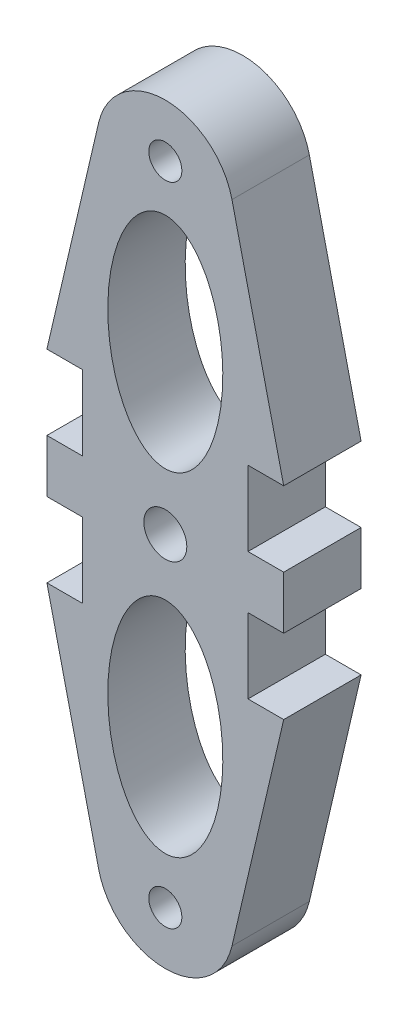
from build123d import *

# Parameters (mm, degrees)
SKETCH1_R           = 1.25
SKETCH1_R_2         = 1.625
SKETCH1_RX          = 8.302080555
SKETCH1_RY          = 4.346497416
BOSS_EXTRUDE1_DEPTH = 5.85


with BuildPart() as part:
    # Sketch1 → Boss-Extrude1 (new body)
    with BuildSketch(Plane.XY):
        with BuildLine():
            Line((781.409168709, 465.402542), (778.709168709, 465.402542))
            Line((778.709168709, 465.402542), (778.709168709, 461.402176393))
            Line((778.709168709, 461.402176393), (781.409168709, 461.402176393))
            Line((781.409168709, 461.402176393), (781.409168709, 455.752176393))
            Line((781.409168709, 455.752176393), (778.709168709, 455.752176393))
            Line((778.709168709, 455.752176393), (782.620179881, 438.967359197))
            ThreePointArc((782.620179881, 438.967359197), (787.659168709, 434.967516139), (792.698157537, 438.967359197))
            Line((792.698157537, 438.967359197), (796.609168709, 455.752176393))
            Line((796.609168709, 455.752176393), (793.909168709, 455.752176393))
            Line((793.909168709, 455.752176393), (793.909168709, 461.402176393))
            Line((793.909168709, 461.402176393), (796.609168709, 461.402176393))
            Line((796.609168709, 461.402176393), (796.609168709, 465.402542))
            Line((796.609168709, 465.402542), (793.909168709, 465.402542))
            Line((793.909168709, 465.402542), (793.909168709, 471.052542))
            Line((793.909168709, 471.052542), (796.609168709, 471.052542))
            Line((796.609168709, 471.052542), (792.698157537, 487.837359197))
            ThreePointArc((792.698157537, 487.837359197), (787.659168709, 491.837202254), (782.620179881, 487.837359197))
            Line((782.620179881, 487.837359197), (778.709168709, 471.052542))
            Line((778.709168709, 471.052542), (781.409168709, 471.052542))
            Line((781.409168709, 471.052542), (781.409168709, 465.402542))
        make_face()
        with Locations((787.659168709, 487.837359197)):
            Circle(SKETCH1_R, mode=Mode.SUBTRACT)
        with Locations((787.659168709, 438.967359197)):
            Circle(SKETCH1_R, mode=Mode.SUBTRACT)
        with Locations((787.659168709, 463.402359197)):
            Circle(SKETCH1_R_2, mode=Mode.SUBTRACT)
        with Locations(Location((787.659168709, 475.998301041), (0, 0, -90))):
            Ellipse(SKETCH1_RX, SKETCH1_RY, mode=Mode.SUBTRACT)
        with Locations(Location((787.659168709, 450.806417352), (0, 0, -90))):
            Ellipse(SKETCH1_RX, SKETCH1_RY, mode=Mode.SUBTRACT)
    extrude(amount=BOSS_EXTRUDE1_DEPTH)


solid = part.part
